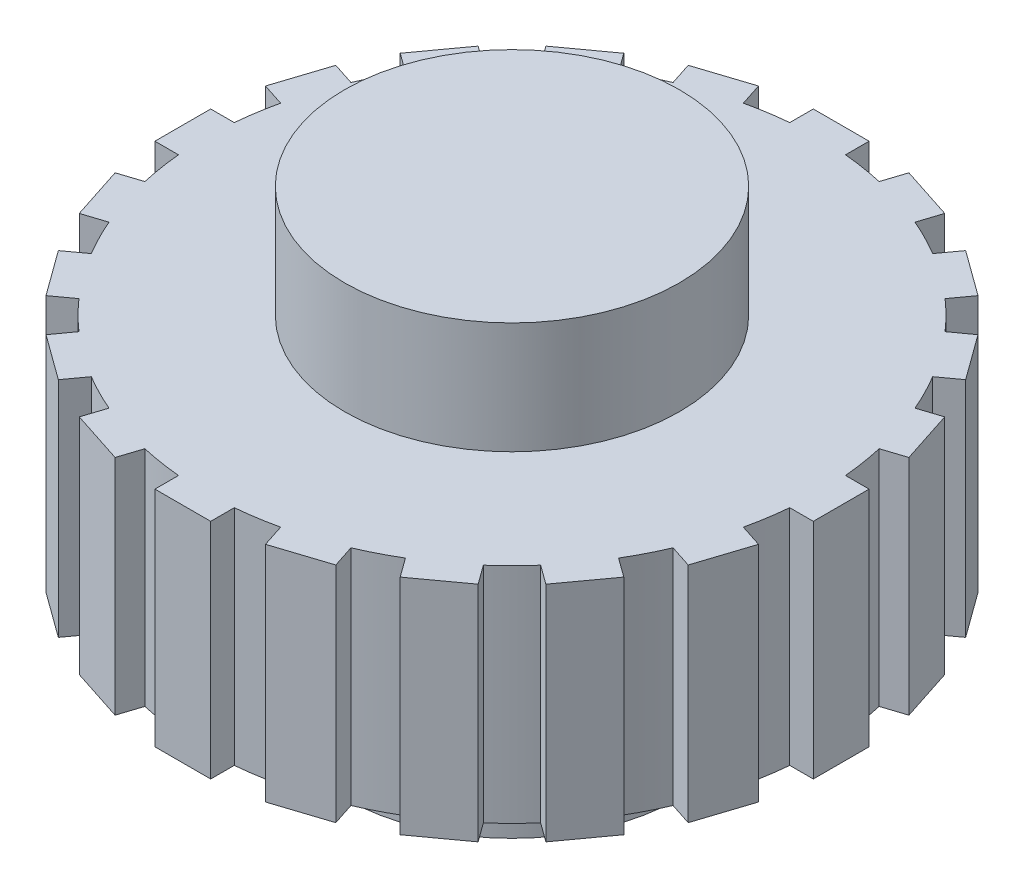
from build123d import *

# Parameters (mm, degrees)
ESQUISSE1_R                  = 15
BOSS_EXTRU_1_DEPTH           = 40
ESQUISSE2_R                  = 27.5
BOSS_EXTRU_2_DEPTH           = 20
ESQUISSE3_W                  = 5
ESQUISSE3_H                  = 20
BOSS_EXTRU_3_DEPTH           = 7
R_P_TITION_CIRCULAIRE1_COUNT = 20


with BuildPart() as part:
    # Esquisse1 → Boss.-Extru.1 (new body)
    with BuildSketch(Plane(origin=(0, 0, 0), x_dir=(1, 0, 0), z_dir=(0, 1, 0))):
        with Locations(Location((0, 0, 0), (0, 0, 270))):
            Circle(ESQUISSE1_R)
    extrude(amount=BOSS_EXTRU_1_DEPTH)

    # Esquisse2 → Boss.-Extru.2 (add)
    with BuildSketch(Plane(origin=(0, 10, 0), x_dir=(-1, 0, 0), z_dir=(0, -1, 0))):
        with Locations(Location((0, 0, 0), (0, 0, 90))):
            Circle(ESQUISSE2_R)
    extrude(amount=-BOSS_EXTRU_2_DEPTH)

    # Esquisse3 → Boss.-Extru.3 (add)
    with BuildSketch(Plane.XY.offset(22.5)):
        with Locations((0, 20)):
            Rectangle(ESQUISSE3_W, ESQUISSE3_H)
    boss_extru_3 = extrude(amount=BOSS_EXTRU_3_DEPTH)

    # Répétition circulaire1: Boss.-Extru.3 ×20 about axis
    r_p_tition_circulaire1_axis = Axis((0, 0, 0), (0, 1, 0))
    for i in range(1, R_P_TITION_CIRCULAIRE1_COUNT):
        add(boss_extru_3.rotate(r_p_tition_circulaire1_axis, i * 360 / R_P_TITION_CIRCULAIRE1_COUNT))


solid = part.part
